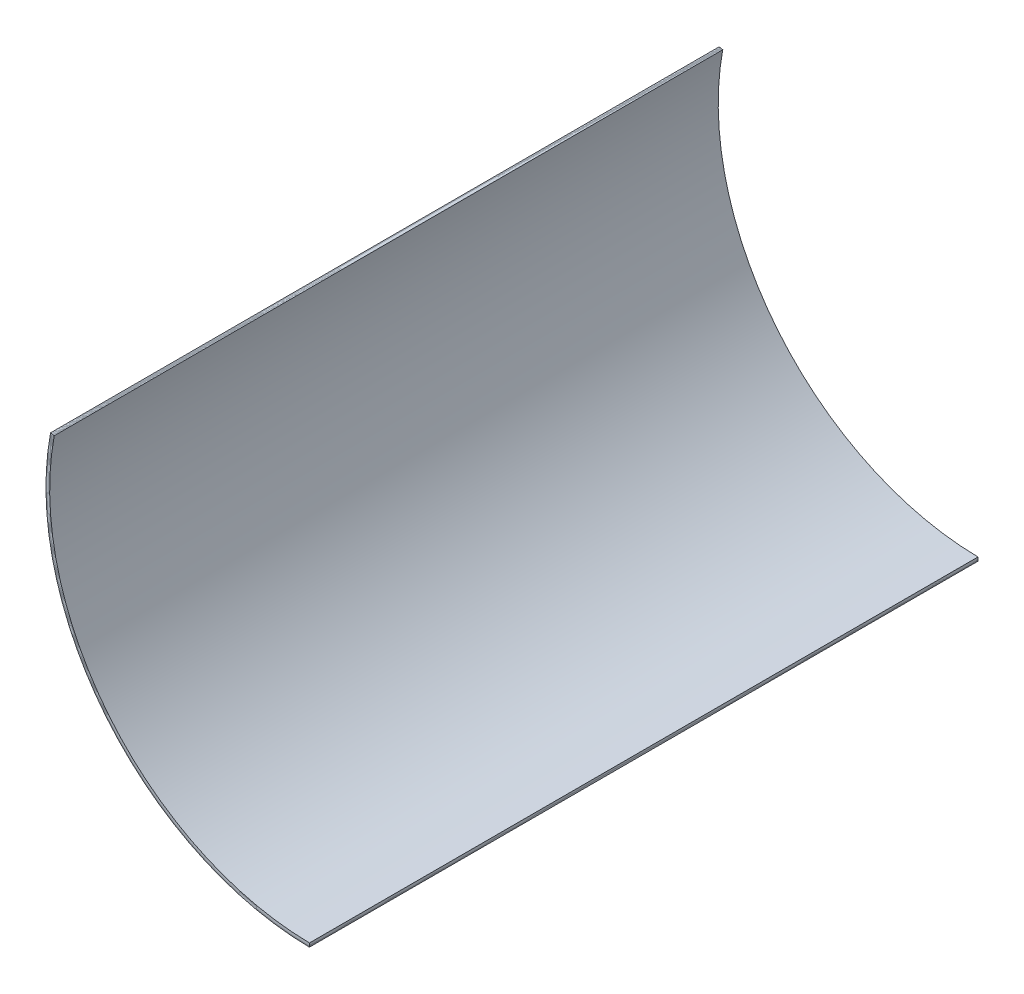
from build123d import *

# Parameters (mm, degrees)
EXTRUDE_THIN1_DEPTH   = 607.06
EXTRUDE_THIN1_2_DEPTH = 607.06


with BuildPart() as part:
    # Sketch1 → Extrude-Thin1 (new body)
    with BuildSketch(Plane.XY):
        with BuildLine():
            ThreePointArc((-2.884425824, -241.282759615), (-186.687390405, -152.883969938), (-237.11625705, 44.738916424))
            Line((-237.11625705, 44.738916424), (-234.620296449, 44.267980462))
            ThreePointArc((-234.620296449, 44.267980462), (-184.722259979, -151.274664991), (-2.854063447, -238.742941093))
            Line((-2.854063447, -238.742941093), (-2.884425824, -241.282759615))
        make_face()
    extrude(amount=EXTRUDE_THIN1_DEPTH)


with BuildPart() as body_2:
    # Sketch1 → Extrude-Thin1 2 (new body)
    with BuildSketch(Plane.XY):
        with BuildLine():
            ThreePointArc((-2.894141785, -242.095501543), (-187.316232141, -153.39894752), (-237.914964442, 44.889615932))
            Line((-237.914964442, 44.889615932), (-235.419003841, 44.41867997))
            ThreePointArc((-235.419003841, 44.41867997), (-185.351101716, -151.789642574), (-2.863779408, -239.55568302))
            Line((-2.863779408, -239.55568302), (-2.894141785, -242.095501543))
        make_face()
    extrude(amount=EXTRUDE_THIN1_2_DEPTH)


solid = Compound([part.part, body_2.part])
